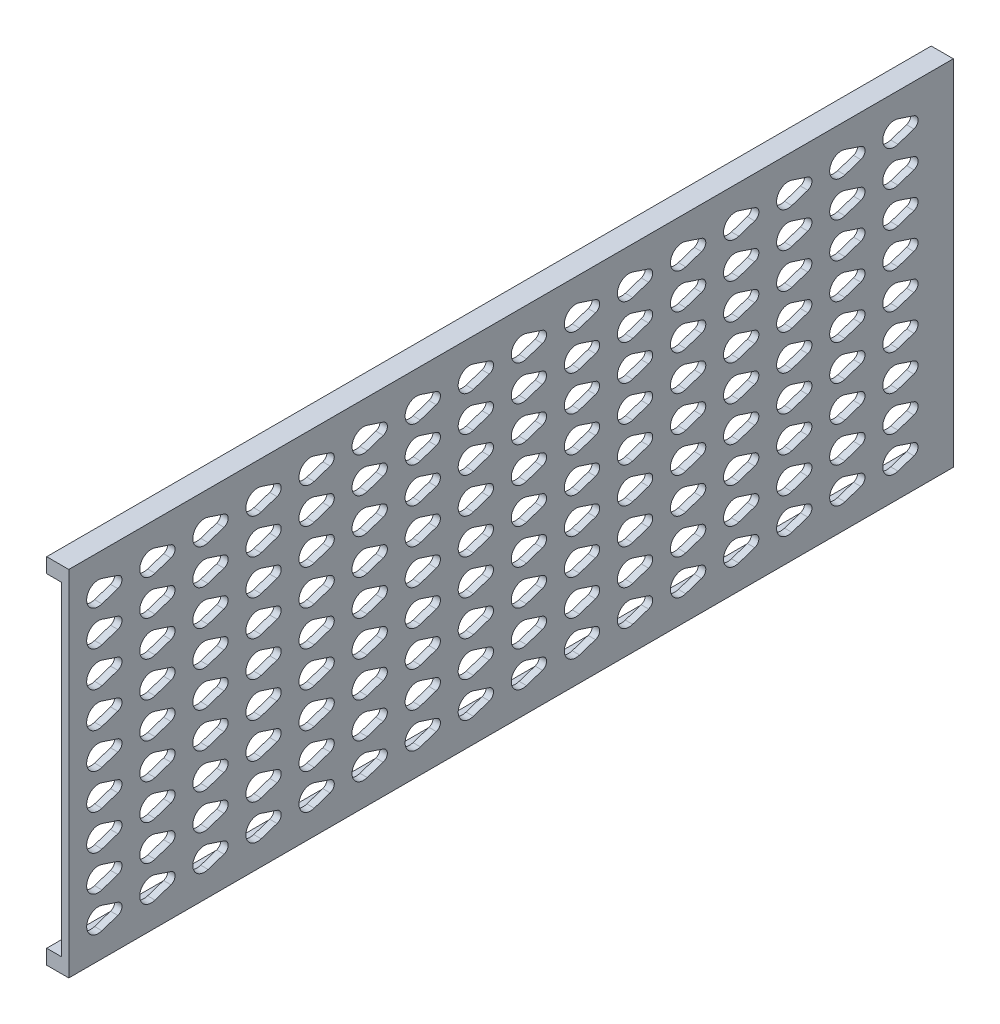
from build123d import *

# Parameters (mm, degrees)
SKETCH1_W            = 152.4
SKETCH1_H            = 381
BOSS_EXTRUDE1_DEPTH  = 3.175
SKETCH2_W            = 6.35
SKETCH2_H            = 381
BOSS_EXTRUDE2_DEPTH  = 6.35
SKETCH3_R            = 2.6
SKETCH3_R_2          = 5
CUT_EXTRUDE1_DEPTH   = 206.395753668
LPATTERN1_COUNT      = 16
LPATTERN1_PITCH      = 22.86
LPATTERN1_COUNT_DIR2 = 9
LPATTERN1_PITCH_DIR2 = 15.24


with BuildPart() as part:
    # Sketch1 → Boss-Extrude1 (new body)
    with BuildSketch(Plane.YZ):
        Rectangle(SKETCH1_W, SKETCH1_H)
    extrude(amount=BOSS_EXTRUDE1_DEPTH)

    # Sketch2 → Boss-Extrude2 (add)
    with BuildSketch(Plane(origin=(0, 0, 0), x_dir=(0, -1, 0), z_dir=(-1, 0, 0))):
        with Locations((-73.025, 0)):
            Rectangle(SKETCH2_W, SKETCH2_H)
        with Locations((73.025, 0)):
            Rectangle(SKETCH2_W, SKETCH2_H)
    extrude(amount=BOSS_EXTRUDE2_DEPTH)

    # Sketch3 → Cut-Extrude1 (cut, symmetric)
    with BuildSketch(Plane.YZ.offset(3.175)):
        with BuildLine():
            ThreePointArc((-56.214476316, 176.22519685), (-60.96, 172.8), (-65.705523684, 176.22519685))
            Line((-65.705523684, 176.22519685), (-63.427672316, 169.361102362))
            ThreePointArc((-63.427672316, 169.361102362), (-61.374760159, 172.746704894), (-58.36, 170.18))
            ThreePointArc((-58.36, 170.18), (-58.393295106, 169.765239841), (-58.492327684, 169.361102362))
            Line((-58.492327684, 169.361102362), (-56.214476316, 176.22519685))
        make_face()
        with Locations((-60.96, 170.18)):
            Circle(SKETCH3_R)
        with Locations((-60.96, 177.8)):
            Circle(SKETCH3_R_2)
    cut_extrude1 = extrude(amount=CUT_EXTRUDE1_DEPTH, both=True, mode=Mode.SUBTRACT)

    # LPattern1: Cut-Extrude1 16 × 9
    with Locations(*[(0, j * LPATTERN1_PITCH_DIR2, -i * LPATTERN1_PITCH) for i in range(LPATTERN1_COUNT) for j in range(LPATTERN1_COUNT_DIR2) if (i, j) != (0, 0)]):
        add(cut_extrude1, mode=Mode.SUBTRACT)


solid = part.part
